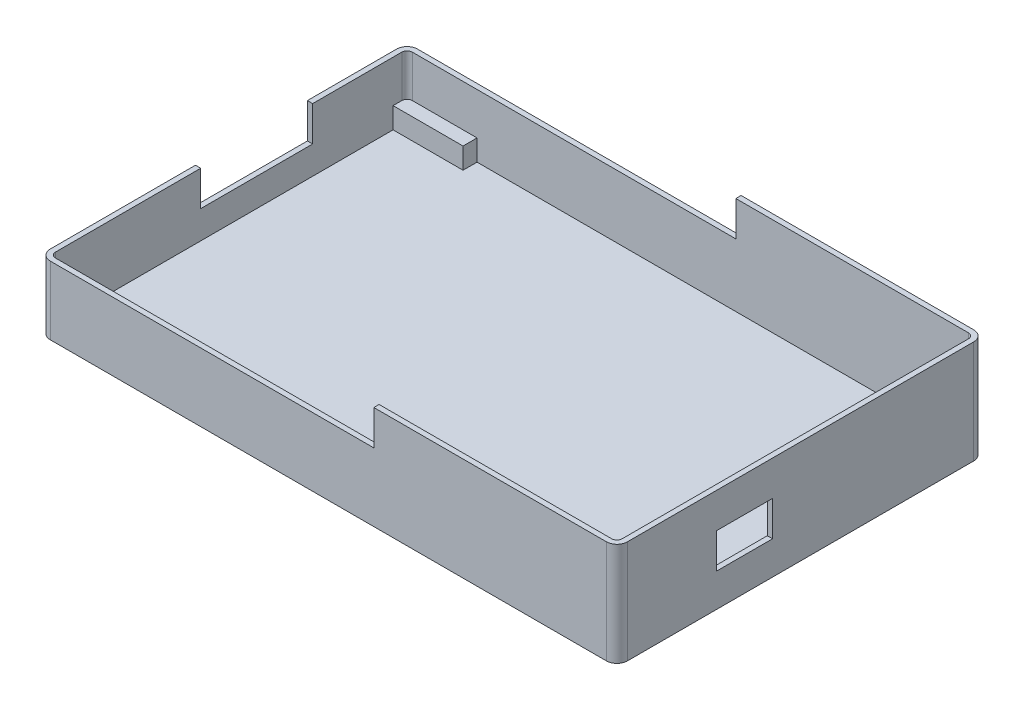
from build123d import *

# Parameters (mm, degrees)
BOSS_EXTRUDE1_DEPTH = 0.75
BOSS_EXTRUDE2_DEPTH = 3.75
BOSS_EXTRUDE3_DEPTH = 9.75
SKETCH1_5_W         = 0.75
SKETCH1_5_H         = 16
SKETCH1_5_H_2       = 8
BOSS_EXTRUDE4_DEPTH = 4.75
BOSS_EXTRUDE5_START = 9.75
BOSS_EXTRUDE5_DEPTH = 5


with BuildPart() as part:
    # Sketch1 → Boss-Extrude1 (new body)
    with BuildSketch(Plane(origin=(0, 0, 0), x_dir=(1, 0, 0), z_dir=(0, 1, 0))):
        with BuildLine():
            Line((0.75, 51.75), (80.25, 51.75))
            ThreePointArc((80.25, 51.75), (81.310660172, 51.310660172), (81.75, 50.25))
            Line((81.75, 50.25), (81.75, 0.75))
            ThreePointArc((81.75, 0.75), (81.310660172, -0.310660172), (80.25, -0.75))
            Line((80.25, -0.75), (0.75, -0.75))
            ThreePointArc((0.75, -0.75), (-0.310660172, -0.310660172), (-0.75, 0.75))
            Line((-0.75, 0.75), (-0.75, 50.25))
            ThreePointArc((-0.75, 50.25), (-0.310660172, 51.310660172), (0.75, 51.75))
        make_face()
    extrude(amount=BOSS_EXTRUDE1_DEPTH)

    # Sketch1<3> → Boss-Extrude2 (add)
    with BuildSketch(Plane(origin=(0, 0, 0), x_dir=(1, 0, 0), z_dir=(0, 1, 0))):
        with BuildLine():
            Line((0, 50.25), (0, 49))
            Line((0, 49), (10, 49))
            Line((10, 49), (10, 51))
            Line((10, 51), (0.75, 51))
            ThreePointArc((0.75, 51), (0.219669914, 50.780330086), (0, 50.25))
        make_face()
        with BuildLine():
            Line((10, 2), (0, 2))
            Line((0, 2), (0, 0.75))
            ThreePointArc((0, 0.75), (0.219669914, 0.219669914), (0.75, 0))
            Line((0.75, 0), (10, 0))
            Line((10, 0), (10, 2))
        make_face()
        with BuildLine():
            Line((80.25, 51), (71, 51))
            Line((71, 51), (71, 49))
            Line((71, 49), (81, 49))
            Line((81, 49), (81, 50.25))
            ThreePointArc((81, 50.25), (80.780330086, 50.780330086), (80.25, 51))
        make_face()
        with BuildLine():
            Line((71, 2), (71, 0))
            Line((71, 0), (80.25, 0))
            ThreePointArc((80.25, 0), (80.780330086, 0.219669914), (81, 0.75))
            Line((81, 0.75), (81, 2))
            Line((81, 2), (71, 2))
        make_face()
    extrude(amount=BOSS_EXTRUDE2_DEPTH)

    # Sketch1<4> → Boss-Extrude3 (add)
    with BuildSketch(Plane(origin=(0, 0, 0), x_dir=(1, 0, 0), z_dir=(0, 1, 0))):
        with BuildLine():
            Line((0, 37.5), (0, 50.25))
            ThreePointArc((0, 50.25), (0.219669914, 50.780330086), (0.75, 51))
            Line((0.75, 51), (80.25, 51))
            ThreePointArc((80.25, 51), (80.780330086, 50.780330086), (81, 50.25))
            Line((81, 50.25), (81, 21.5))
            Line((81, 21.5), (81.75, 21.5))
            Line((81.75, 21.5), (81.75, 50.25))
            ThreePointArc((81.75, 50.25), (81.310660172, 51.310660172), (80.25, 51.75))
            Line((80.25, 51.75), (0.75, 51.75))
            ThreePointArc((0.75, 51.75), (-0.310660172, 51.310660172), (-0.75, 50.25))
            Line((-0.75, 50.25), (-0.75, 37.5))
            Line((-0.75, 37.5), (0, 37.5))
        make_face()
        with BuildLine():
            Line((0, 21.5), (-0.75, 21.5))
            Line((-0.75, 21.5), (-0.75, 0.75))
            ThreePointArc((-0.75, 0.75), (-0.310660172, -0.310660172), (0.75, -0.75))
            Line((0.75, -0.75), (80.25, -0.75))
            ThreePointArc((80.25, -0.75), (81.310660172, -0.310660172), (81.75, 0.75))
            Line((81.75, 0.75), (81.75, 13.5))
            Line((81.75, 13.5), (81, 13.5))
            Line((81, 13.5), (81, 0.75))
            ThreePointArc((81, 0.75), (80.780330086, 0.219669914), (80.25, 0))
            Line((80.25, 0), (0.75, 0))
            ThreePointArc((0.75, 0), (0.219669914, 0.219669914), (0, 0.75))
            Line((0, 0.75), (0, 21.5))
        make_face()
    extrude(amount=BOSS_EXTRUDE3_DEPTH)

    # Sketch1<5> → Boss-Extrude4 (add)
    with BuildSketch(Plane(origin=(0, 0, 0), x_dir=(1, 0, 0), z_dir=(0, 1, 0))):
        with Locations((-0.375, 29.5)):
            Rectangle(SKETCH1_5_W, SKETCH1_5_H)
        with Locations((81.375, 17.5)):
            Rectangle(SKETCH1_5_W, SKETCH1_5_H_2)
    extrude(amount=BOSS_EXTRUDE4_DEPTH)

    # Sketch1<8> → Boss-Extrude5 (add)
    with BuildSketch(Plane(origin=(0, 0, 0), x_dir=(1, 0, 0), z_dir=(0, 1, 0)).offset(BOSS_EXTRUDE5_START)):
        with BuildLine():
            Line((47, 51.75), (47, 51))
            Line((47, 51), (80.25, 51))
            ThreePointArc((80.25, 51), (80.780330086, 50.780330086), (81, 50.25))
            Line((81, 50.25), (81, 0.75))
            ThreePointArc((81, 0.75), (80.780330086, 0.219669914), (80.25, 0))
            Line((80.25, 0), (47, 0))
            Line((47, 0), (47, -0.75))
            Line((47, -0.75), (80.25, -0.75))
            ThreePointArc((80.25, -0.75), (81.310660172, -0.310660172), (81.75, 0.75))
            Line((81.75, 0.75), (81.75, 50.25))
            ThreePointArc((81.75, 50.25), (81.310660172, 51.310660172), (80.25, 51.75))
            Line((80.25, 51.75), (47, 51.75))
        make_face()
    extrude(amount=BOSS_EXTRUDE5_DEPTH)


solid = part.part
